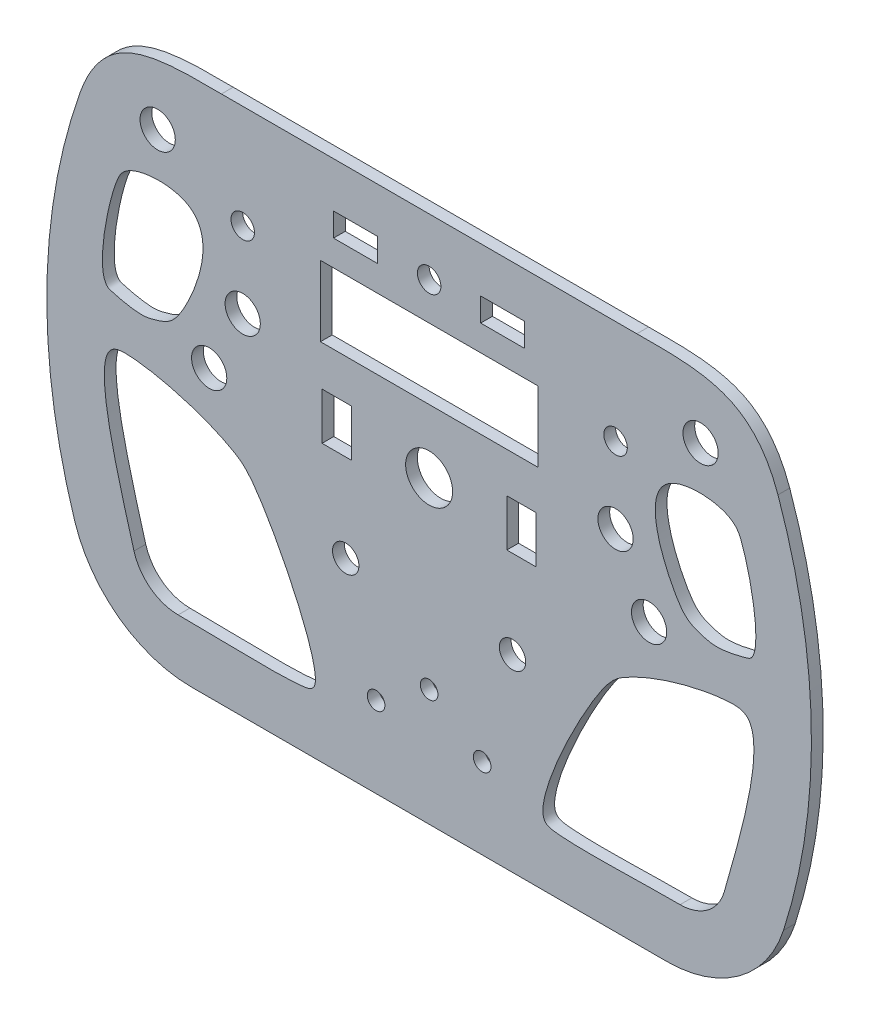
from build123d import *

# Parameters (mm, degrees)
COMBINE_SKETCH_R    = 6
COMBINE_SKETCH_R_2  = 4
COMBINE_SKETCH_R_3  = 3
COMBINE_SKETCH_R_4  = 8
COMBINE_SKETCH_R_5  = 4.5
COMBINE_SKETCH_W    = 15
COMBINE_SKETCH_H    = 8
COMBINE_SKETCH_W_2  = 10
COMBINE_SKETCH_H_2  = 16
COMBINE_SKETCH_W_3  = 74
COMBINE_SKETCH_H_3  = 24
BOSS_EXTRUDE1_DEPTH = 4


with BuildPart() as part:
    # Combine Sketch → Boss-Extrude1 (new body)
    with BuildSketch(Plane.XY):
        with BuildLine():
            Line((70.715911751, 90), (-70.715911751, 90))
            add(Edge.make_bspline(
                [(-70.715911751, 90), (-81.041533891, 90), (-104.041866976, 90.994896053), (-115.640224719, 75.444672668), (-118.783078497, 66.535650037)],
                knots=[0, 0, 0, 0, 0.581145419, 1, 1, 1, 1], degree=3))
            ThreePointArc((-118.783078497, 66.535650037), (-130.153450214, 2.935889968), (-120.654996599, -60.970245988))
            ThreePointArc((-120.654996599, -60.970245988), (-105.50238667, -81.970655113), (-80.882305603, -90))
            Line((-80.882305603, -90), (80.882305603, -90))
            ThreePointArc((80.882305603, -90), (105.50238667, -81.970655113), (120.654996599, -60.970245988))
            ThreePointArc((120.654996599, -60.970245988), (130.153450214, 2.935889968), (118.783078497, 66.535650037))
            add(Edge.make_bspline(
                [(118.783078497, 66.535650037), (115.640224719, 75.444672668), (104.041866976, 90.994896053), (81.041533891, 90), (70.715911751, 90)],
                knots=[0, 0, 0, 0, 0.418854581, 1, 1, 1, 1], degree=3))
        make_face()
        with Locations((-92.431821659, 68.627843491)):
            Circle(COMBINE_SKETCH_R, mode=Mode.SUBTRACT)
        with Locations((-63.477275115, 54.707388422)):
            Circle(COMBINE_SKETCH_R_2, mode=Mode.SUBTRACT)
        with Locations((0, 70.5767072)):
            Circle(COMBINE_SKETCH_R_2, mode=Mode.SUBTRACT)
        with Locations((-63.477275115, 28.815341993)):
            Circle(COMBINE_SKETCH_R, mode=Mode.SUBTRACT)
        with Locations((-74.892048272, 7.099432085)):
            Circle(COMBINE_SKETCH_R, mode=Mode.SUBTRACT)
        with Locations((0, -50.2528428)):
            Circle(COMBINE_SKETCH_R_3, mode=Mode.SUBTRACT)
        with Locations((-18.05585105, -62.50284326)):
            Circle(COMBINE_SKETCH_R_3, mode=Mode.SUBTRACT)
        with Locations((0, 12.11079591)):
            Circle(COMBINE_SKETCH_R_4, mode=Mode.SUBTRACT)
        with Locations((-28.397728341, -25.752841878)):
            Circle(COMBINE_SKETCH_R_5, mode=Mode.SUBTRACT)
        with Locations((92.431821659, 68.627843491)):
            Circle(COMBINE_SKETCH_R, mode=Mode.SUBTRACT)
        with Locations((63.477275115, 54.707388422)):
            Circle(COMBINE_SKETCH_R_2, mode=Mode.SUBTRACT)
        with Locations((28.397728341, -25.752841878)):
            Circle(COMBINE_SKETCH_R_5, mode=Mode.SUBTRACT)
        with Locations((18.05585105, -62.50284326)):
            Circle(COMBINE_SKETCH_R_3, mode=Mode.SUBTRACT)
        with Locations((74.892048272, 7.099432085)):
            Circle(COMBINE_SKETCH_R, mode=Mode.SUBTRACT)
        with Locations((63.477275115, 28.815341993)):
            Circle(COMBINE_SKETCH_R, mode=Mode.SUBTRACT)
        with BuildLine():
            add(Edge.make_bspline(
                [(-109.136367742, 13.502841417), (-108.866388047, 13.346079014), (-106.174063441, 12.49802794), (-98.890606721, 10.725797818), (-89.452498482, 12.906961625), (-86.503822288, 14.965236876), (-78.883403474, 28.708216913), (-69.786057373, 55.937241409), (-102.607531639, 54.193791639), (-108.940331968, 41.905740233), (-113.808396618, 16.215632378), (-109.136367742, 13.502841417)],
                knots=[0, 0, 0, 0, 0.01132108, 0.101889719, 0.134423522, 0.304125313, 0.353965844, 0.611616116, 0.765249056, 0.804087444, 1, 1, 1, 1], degree=3))
        make_face(mode=Mode.SUBTRACT)
        with BuildLine():
            add(Edge.make_bspline(
                [(109.136367742, 13.502841417), (113.808396618, 16.215632378), (108.940331968, 41.905740233), (102.607531639, 54.193791639), (69.786057373, 55.937241409), (78.883403474, 28.708216913), (86.503822288, 14.965236876), (89.452498482, 12.906961625), (98.890606721, 10.725797818), (106.174063441, 12.49802794), (108.866388047, 13.346079014), (109.136367742, 13.502841417)],
                knots=[0, 0, 0, 0, 0.195912556, 0.234750944, 0.388383884, 0.646034156, 0.695874687, 0.865576478, 0.898110281, 0.98867892, 1, 1, 1, 1], degree=3))
        make_face(mode=Mode.SUBTRACT)
        with Locations((-25.056819124, 70.5767072)):
            Rectangle(COMBINE_SKETCH_W, COMBINE_SKETCH_H, mode=Mode.SUBTRACT)
        with Locations((31.460228456, 12.11079591)):
            Rectangle(COMBINE_SKETCH_W_2, COMBINE_SKETCH_H_2, mode=Mode.SUBTRACT)
        with Locations((-31.460228456, 12.11079591)):
            Rectangle(COMBINE_SKETCH_W_2, COMBINE_SKETCH_H_2, mode=Mode.SUBTRACT)
        with Locations((25.056819124, 70.5767072)):
            Rectangle(COMBINE_SKETCH_W, COMBINE_SKETCH_H, mode=Mode.SUBTRACT)
        with Locations((0, 45.798297177)):
            Rectangle(COMBINE_SKETCH_W_3, COMBINE_SKETCH_H_3, mode=Mode.SUBTRACT)
        with BuildLine():
            ThreePointArc((-100.490518571, -59.663962287), (-94.871086727, -67.842830883), (-85.453353395, -70.96984298))
            add(Edge.make_bspline(
                [(-85.453353395, -70.96984298), (-71.347430257, -70.920051649), (-49.008879589, -72.089859198), (-32.631774794, -69.035966839), (-56.974496218, -20.003686891), (-72.063849339, -9.126035687), (-94.68934323, -2.512963266), (-116.874926915, -2.97989148), (-106.343233958, -39.147055599), (-100.490518571, -59.663962287)],
                knots=[0, 0, 0, 0, 0.188214848, 0.230321534, 0.399872935, 0.450397126, 0.685039251, 0.742932565, 1, 1, 1, 1], degree=3))
        make_face(mode=Mode.SUBTRACT)
        with BuildLine():
            ThreePointArc((85.453353395, -70.96984298), (94.871086727, -67.842830883), (100.490518571, -59.663962287))
            add(Edge.make_bspline(
                [(100.490518571, -59.663962287), (106.343233958, -39.147055599), (116.874926915, -2.97989148), (94.68934323, -2.512963266), (72.063849339, -9.126035687), (56.974496218, -20.003686891), (32.631774794, -69.035966839), (49.008879589, -72.089859198), (71.347430257, -70.920051649), (85.453353395, -70.96984298)],
                knots=[0, 0, 0, 0, 0.257067435, 0.314960749, 0.549602874, 0.600127065, 0.769678466, 0.811785152, 1, 1, 1, 1], degree=3))
        make_face(mode=Mode.SUBTRACT)
    extrude(amount=BOSS_EXTRUDE1_DEPTH)


solid = part.part
